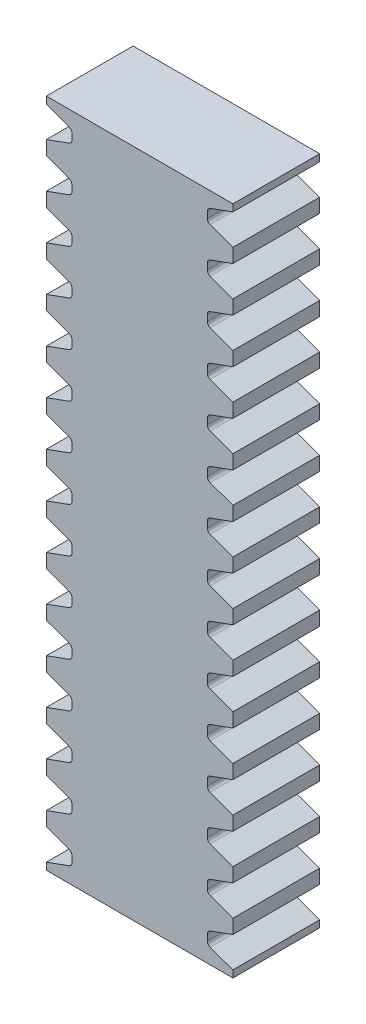
from build123d import *

# Parameters (mm, degrees)
SKETCHCI_M_STRSKETCHNAME_W         = 8.60044
SKETCHCI_M_STRSKETCHNAME_H         = 61.817118644
EXTRUDECI_DEPTH                    = 4
TOOTHEXTRUDECUTGEARTRAX1GEAR_DEPTH = 4
PATTERNGEARTRAX1GEAR_COUNT         = 15
PATTERNGEARTRAX1GEAR_PITCH         = 4.121141305
MIRROR1_COPY_1_DEPTH               = 4
MIRROR1_COPY_2_DEPTH               = 4
MIRROR1_COPY_3_DEPTH               = 4
MIRROR1_COPY_4_DEPTH               = 4
MIRROR1_COPY_5_DEPTH               = 4
MIRROR1_COPY_6_DEPTH               = 4
MIRROR1_COPY_7_DEPTH               = 4
MIRROR1_COPY_8_DEPTH               = 4
MIRROR1_COPY_9_DEPTH               = 4
MIRROR1_COPY_10_DEPTH              = 4
MIRROR1_COPY_11_DEPTH              = 4
MIRROR1_COPY_12_DEPTH              = 4
MIRROR1_COPY_13_DEPTH              = 4
MIRROR1_COPY_14_DEPTH              = 4


with BuildPart() as part:
    # SketchCI.m_strSketchName → ExtrudeCI (new, symmetric)
    with BuildSketch(Plane.XY):
        with Locations((3.25078, -28.847988701)):
            Rectangle(SKETCHCI_M_STRSKETCHNAME_W, SKETCHCI_M_STRSKETCHNAME_H)
    extrudeci = extrude(amount=EXTRUDECI_DEPTH, both=True)

    # SketchToothGeartrax1Gear → ToothExtrudeCutGeartrax1Gear (cut, symmetric)
    with BuildSketch(Plane.XY):
        with BuildLine():
            Line((-1.04944, 1.412250233), (-1.04944, -1.412250233))
            Line((-1.04944, -1.412250233), (1.052858607, -0.647076117))
            ThreePointArc((1.052858607, -0.647076117), (1.240629096, -0.502994754), (1.3118, -0.277269483))
            Line((1.3118, -0.277269483), (1.3118, 0.277269483))
            ThreePointArc((1.3118, 0.277269483), (1.240629096, 0.502994754), (1.052858607, 0.647076117))
            Line((1.052858607, 0.647076117), (-1.04944, 1.412250233))
        make_face()
    toothextrudecutgeartrax1gear = extrude(amount=TOOTHEXTRUDECUTGEARTRAX1GEAR_DEPTH, both=True, mode=Mode.SUBTRACT)

    # PatternGeartrax1Gear: ToothExtrudeCutGeartrax1Gear ×15
    with Locations(*[(0, -i * PATTERNGEARTRAX1GEAR_PITCH, 0) for i in range(1, PATTERNGEARTRAX1GEAR_COUNT)]):
        add(toothextrudecutgeartrax1gear, mode=Mode.SUBTRACT)

    # Mirror1: ExtrudeCI, ToothExtrudeCutGeartrax1Gear across plane
    add(extrudeci.mirror(Plane(origin=(7.551, -59.756548023, -4), x_dir=(0, 0, 1), z_dir=(1, 0, 0))))
    add(toothextrudecutgeartrax1gear.mirror(Plane(origin=(7.551, -59.756548023, -4), x_dir=(0, 0, 1), z_dir=(1, 0, 0))), mode=Mode.SUBTRACT)

    # Mirror1 copy 1 sketch → Mirror1 copy 1 (cut, symmetric)
    with BuildSketch(Plane(origin=(15.102, -4.121141305, 0), x_dir=(-1, 0, 0), z_dir=(0, 0, 1))):
        with BuildLine():
            Line((-1.04944, -1.412250233), (-1.04944, 1.412250233))
            Line((-1.04944, 1.412250233), (1.052858607, 0.647076117))
            ThreePointArc((1.052858607, 0.647076117), (1.240629096, 0.502994754), (1.3118, 0.277269483))
            Line((1.3118, 0.277269483), (1.3118, -0.277269483))
            ThreePointArc((1.3118, -0.277269483), (1.240629096, -0.502994754), (1.052858607, -0.647076117))
            Line((1.052858607, -0.647076117), (-1.04944, -1.412250233))
        make_face()
    extrude(amount=MIRROR1_COPY_1_DEPTH, both=True, mode=Mode.SUBTRACT)

    # Mirror1 copy 2 sketch → Mirror1 copy 2 (cut, symmetric)
    with BuildSketch(Plane(origin=(15.102, -8.24228261, 0), x_dir=(-1, 0, 0), z_dir=(0, 0, 1))):
        with BuildLine():
            Line((-1.04944, -1.412250233), (-1.04944, 1.412250233))
            Line((-1.04944, 1.412250233), (1.052858607, 0.647076117))
            ThreePointArc((1.052858607, 0.647076117), (1.240629096, 0.502994754), (1.3118, 0.277269483))
            Line((1.3118, 0.277269483), (1.3118, -0.277269483))
            ThreePointArc((1.3118, -0.277269483), (1.240629096, -0.502994754), (1.052858607, -0.647076117))
            Line((1.052858607, -0.647076117), (-1.04944, -1.412250233))
        make_face()
    extrude(amount=MIRROR1_COPY_2_DEPTH, both=True, mode=Mode.SUBTRACT)

    # Mirror1 copy 3 sketch → Mirror1 copy 3 (cut, symmetric)
    with BuildSketch(Plane(origin=(15.102, -12.363423915, 0), x_dir=(-1, 0, 0), z_dir=(0, 0, 1))):
        with BuildLine():
            Line((-1.04944, -1.412250233), (-1.04944, 1.412250233))
            Line((-1.04944, 1.412250233), (1.052858607, 0.647076117))
            ThreePointArc((1.052858607, 0.647076117), (1.240629096, 0.502994754), (1.3118, 0.277269483))
            Line((1.3118, 0.277269483), (1.3118, -0.277269483))
            ThreePointArc((1.3118, -0.277269483), (1.240629096, -0.502994754), (1.052858607, -0.647076117))
            Line((1.052858607, -0.647076117), (-1.04944, -1.412250233))
        make_face()
    extrude(amount=MIRROR1_COPY_3_DEPTH, both=True, mode=Mode.SUBTRACT)

    # Mirror1 copy 4 sketch → Mirror1 copy 4 (cut, symmetric)
    with BuildSketch(Plane(origin=(15.102, -16.484565219, 0), x_dir=(-1, 0, 0), z_dir=(0, 0, 1))):
        with BuildLine():
            Line((-1.04944, -1.412250233), (-1.04944, 1.412250233))
            Line((-1.04944, 1.412250233), (1.052858607, 0.647076117))
            ThreePointArc((1.052858607, 0.647076117), (1.240629096, 0.502994754), (1.3118, 0.277269483))
            Line((1.3118, 0.277269483), (1.3118, -0.277269483))
            ThreePointArc((1.3118, -0.277269483), (1.240629096, -0.502994754), (1.052858607, -0.647076117))
            Line((1.052858607, -0.647076117), (-1.04944, -1.412250233))
        make_face()
    extrude(amount=MIRROR1_COPY_4_DEPTH, both=True, mode=Mode.SUBTRACT)

    # Mirror1 copy 5 sketch → Mirror1 copy 5 (cut, symmetric)
    with BuildSketch(Plane(origin=(15.102, -20.605706524, 0), x_dir=(-1, 0, 0), z_dir=(0, 0, 1))):
        with BuildLine():
            Line((-1.04944, -1.412250233), (-1.04944, 1.412250233))
            Line((-1.04944, 1.412250233), (1.052858607, 0.647076117))
            ThreePointArc((1.052858607, 0.647076117), (1.240629096, 0.502994754), (1.3118, 0.277269483))
            Line((1.3118, 0.277269483), (1.3118, -0.277269483))
            ThreePointArc((1.3118, -0.277269483), (1.240629096, -0.502994754), (1.052858607, -0.647076117))
            Line((1.052858607, -0.647076117), (-1.04944, -1.412250233))
        make_face()
    extrude(amount=MIRROR1_COPY_5_DEPTH, both=True, mode=Mode.SUBTRACT)

    # Mirror1 copy 6 sketch → Mirror1 copy 6 (cut, symmetric)
    with BuildSketch(Plane(origin=(15.102, -24.726847829, 0), x_dir=(-1, 0, 0), z_dir=(0, 0, 1))):
        with BuildLine():
            Line((-1.04944, -1.412250233), (-1.04944, 1.412250233))
            Line((-1.04944, 1.412250233), (1.052858607, 0.647076117))
            ThreePointArc((1.052858607, 0.647076117), (1.240629096, 0.502994754), (1.3118, 0.277269483))
            Line((1.3118, 0.277269483), (1.3118, -0.277269483))
            ThreePointArc((1.3118, -0.277269483), (1.240629096, -0.502994754), (1.052858607, -0.647076117))
            Line((1.052858607, -0.647076117), (-1.04944, -1.412250233))
        make_face()
    extrude(amount=MIRROR1_COPY_6_DEPTH, both=True, mode=Mode.SUBTRACT)

    # Mirror1 copy 7 sketch → Mirror1 copy 7 (cut, symmetric)
    with BuildSketch(Plane(origin=(15.102, -28.847989134, 0), x_dir=(-1, 0, 0), z_dir=(0, 0, 1))):
        with BuildLine():
            Line((-1.04944, -1.412250233), (-1.04944, 1.412250233))
            Line((-1.04944, 1.412250233), (1.052858607, 0.647076117))
            ThreePointArc((1.052858607, 0.647076117), (1.240629096, 0.502994754), (1.3118, 0.277269483))
            Line((1.3118, 0.277269483), (1.3118, -0.277269483))
            ThreePointArc((1.3118, -0.277269483), (1.240629096, -0.502994754), (1.052858607, -0.647076117))
            Line((1.052858607, -0.647076117), (-1.04944, -1.412250233))
        make_face()
    extrude(amount=MIRROR1_COPY_7_DEPTH, both=True, mode=Mode.SUBTRACT)

    # Mirror1 copy 8 sketch → Mirror1 copy 8 (cut, symmetric)
    with BuildSketch(Plane(origin=(15.102, -32.969130439, 0), x_dir=(-1, 0, 0), z_dir=(0, 0, 1))):
        with BuildLine():
            Line((-1.04944, -1.412250233), (-1.04944, 1.412250233))
            Line((-1.04944, 1.412250233), (1.052858607, 0.647076117))
            ThreePointArc((1.052858607, 0.647076117), (1.240629096, 0.502994754), (1.3118, 0.277269483))
            Line((1.3118, 0.277269483), (1.3118, -0.277269483))
            ThreePointArc((1.3118, -0.277269483), (1.240629096, -0.502994754), (1.052858607, -0.647076117))
            Line((1.052858607, -0.647076117), (-1.04944, -1.412250233))
        make_face()
    extrude(amount=MIRROR1_COPY_8_DEPTH, both=True, mode=Mode.SUBTRACT)

    # Mirror1 copy 9 sketch → Mirror1 copy 9 (cut, symmetric)
    with BuildSketch(Plane(origin=(15.102, -37.090271744, 0), x_dir=(-1, 0, 0), z_dir=(0, 0, 1))):
        with BuildLine():
            Line((-1.04944, -1.412250233), (-1.04944, 1.412250233))
            Line((-1.04944, 1.412250233), (1.052858607, 0.647076117))
            ThreePointArc((1.052858607, 0.647076117), (1.240629096, 0.502994754), (1.3118, 0.277269483))
            Line((1.3118, 0.277269483), (1.3118, -0.277269483))
            ThreePointArc((1.3118, -0.277269483), (1.240629096, -0.502994754), (1.052858607, -0.647076117))
            Line((1.052858607, -0.647076117), (-1.04944, -1.412250233))
        make_face()
    extrude(amount=MIRROR1_COPY_9_DEPTH, both=True, mode=Mode.SUBTRACT)

    # Mirror1 copy 10 sketch → Mirror1 copy 10 (cut, symmetric)
    with BuildSketch(Plane(origin=(15.102, -41.211413049, 0), x_dir=(-1, 0, 0), z_dir=(0, 0, 1))):
        with BuildLine():
            Line((-1.04944, -1.412250233), (-1.04944, 1.412250233))
            Line((-1.04944, 1.412250233), (1.052858607, 0.647076117))
            ThreePointArc((1.052858607, 0.647076117), (1.240629096, 0.502994754), (1.3118, 0.277269483))
            Line((1.3118, 0.277269483), (1.3118, -0.277269483))
            ThreePointArc((1.3118, -0.277269483), (1.240629096, -0.502994754), (1.052858607, -0.647076117))
            Line((1.052858607, -0.647076117), (-1.04944, -1.412250233))
        make_face()
    extrude(amount=MIRROR1_COPY_10_DEPTH, both=True, mode=Mode.SUBTRACT)

    # Mirror1 copy 11 sketch → Mirror1 copy 11 (cut, symmetric)
    with BuildSketch(Plane(origin=(15.102, -45.332554354, 0), x_dir=(-1, 0, 0), z_dir=(0, 0, 1))):
        with BuildLine():
            Line((-1.04944, -1.412250233), (-1.04944, 1.412250233))
            Line((-1.04944, 1.412250233), (1.052858607, 0.647076117))
            ThreePointArc((1.052858607, 0.647076117), (1.240629096, 0.502994754), (1.3118, 0.277269483))
            Line((1.3118, 0.277269483), (1.3118, -0.277269483))
            ThreePointArc((1.3118, -0.277269483), (1.240629096, -0.502994754), (1.052858607, -0.647076117))
            Line((1.052858607, -0.647076117), (-1.04944, -1.412250233))
        make_face()
    extrude(amount=MIRROR1_COPY_11_DEPTH, both=True, mode=Mode.SUBTRACT)

    # Mirror1 copy 12 sketch → Mirror1 copy 12 (cut, symmetric)
    with BuildSketch(Plane(origin=(15.102, -49.453695658, 0), x_dir=(-1, 0, 0), z_dir=(0, 0, 1))):
        with BuildLine():
            Line((-1.04944, -1.412250233), (-1.04944, 1.412250233))
            Line((-1.04944, 1.412250233), (1.052858607, 0.647076117))
            ThreePointArc((1.052858607, 0.647076117), (1.240629096, 0.502994754), (1.3118, 0.277269483))
            Line((1.3118, 0.277269483), (1.3118, -0.277269483))
            ThreePointArc((1.3118, -0.277269483), (1.240629096, -0.502994754), (1.052858607, -0.647076117))
            Line((1.052858607, -0.647076117), (-1.04944, -1.412250233))
        make_face()
    extrude(amount=MIRROR1_COPY_12_DEPTH, both=True, mode=Mode.SUBTRACT)

    # Mirror1 copy 13 sketch → Mirror1 copy 13 (cut, symmetric)
    with BuildSketch(Plane(origin=(15.102, -53.574836963, 0), x_dir=(-1, 0, 0), z_dir=(0, 0, 1))):
        with BuildLine():
            Line((-1.04944, -1.412250233), (-1.04944, 1.412250233))
            Line((-1.04944, 1.412250233), (1.052858607, 0.647076117))
            ThreePointArc((1.052858607, 0.647076117), (1.240629096, 0.502994754), (1.3118, 0.277269483))
            Line((1.3118, 0.277269483), (1.3118, -0.277269483))
            ThreePointArc((1.3118, -0.277269483), (1.240629096, -0.502994754), (1.052858607, -0.647076117))
            Line((1.052858607, -0.647076117), (-1.04944, -1.412250233))
        make_face()
    extrude(amount=MIRROR1_COPY_13_DEPTH, both=True, mode=Mode.SUBTRACT)

    # Mirror1 copy 14 sketch → Mirror1 copy 14 (cut, symmetric)
    with BuildSketch(Plane(origin=(15.102, -57.695978268, 0), x_dir=(-1, 0, 0), z_dir=(0, 0, 1))):
        with BuildLine():
            Line((-1.04944, -1.412250233), (-1.04944, 1.412250233))
            Line((-1.04944, 1.412250233), (1.052858607, 0.647076117))
            ThreePointArc((1.052858607, 0.647076117), (1.240629096, 0.502994754), (1.3118, 0.277269483))
            Line((1.3118, 0.277269483), (1.3118, -0.277269483))
            ThreePointArc((1.3118, -0.277269483), (1.240629096, -0.502994754), (1.052858607, -0.647076117))
            Line((1.052858607, -0.647076117), (-1.04944, -1.412250233))
        make_face()
    extrude(amount=MIRROR1_COPY_14_DEPTH, both=True, mode=Mode.SUBTRACT)


solid = part.part
